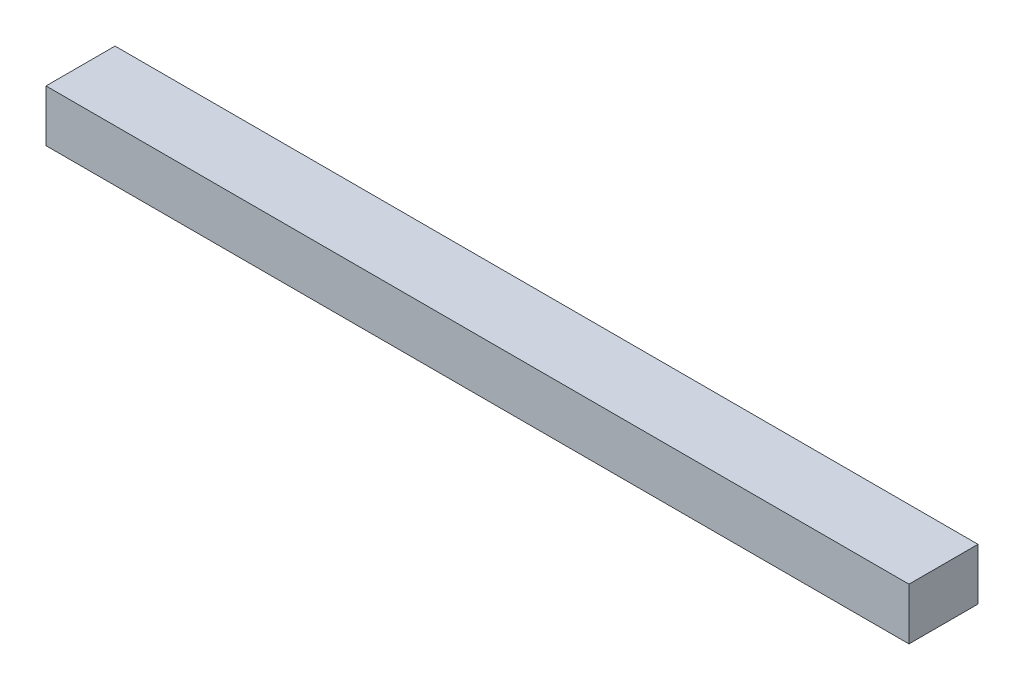
from build123d import *

# Parameters (mm, degrees)
SKETCH1_W           = 50
SKETCH1_H           = 4
BOSS_EXTRUDE1_DEPTH = 3


with BuildPart() as part:
    # Sketch1 → Boss-Extrude1 (new body)
    with BuildSketch(Plane(origin=(0, 0, 0), x_dir=(1, 0, 0), z_dir=(0, 1, 0))):
        with Locations((-25, 2)):
            Rectangle(SKETCH1_W, SKETCH1_H)
    extrude(amount=BOSS_EXTRUDE1_DEPTH)


solid = part.part
